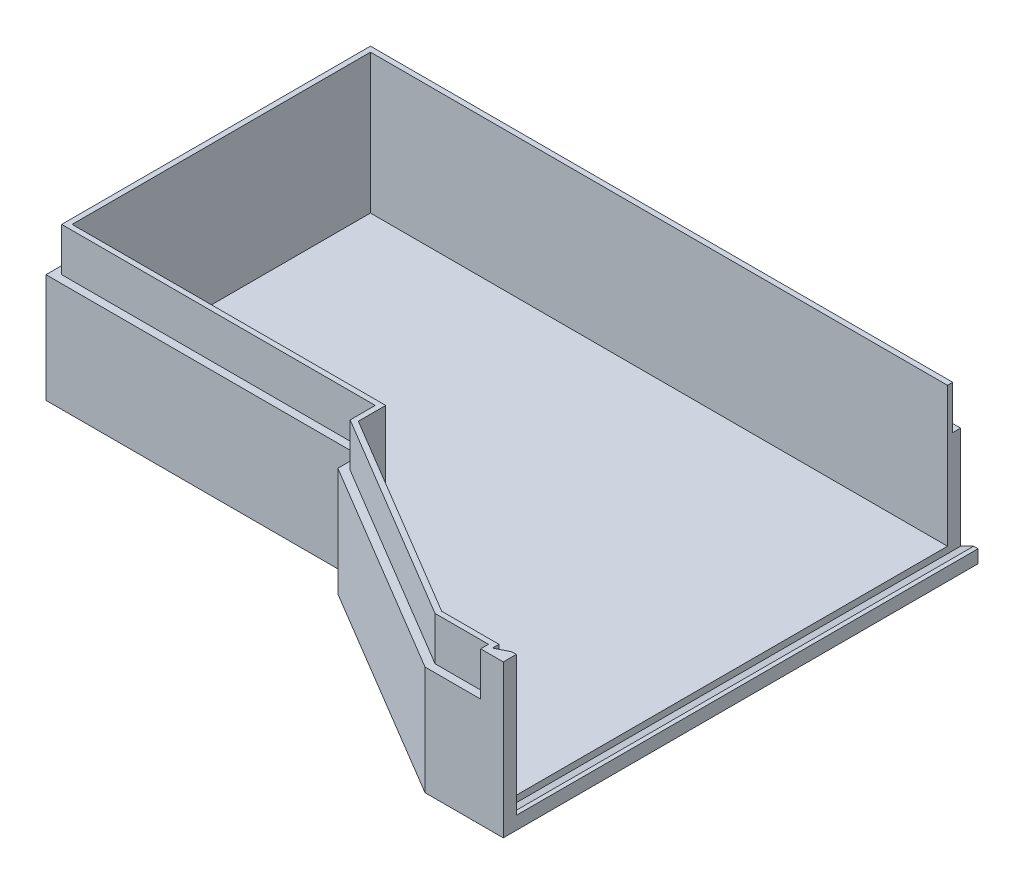
from build123d import *

# Parameters (mm, degrees)
BOSS_EXTRUDE1_DEPTH = 35
CUT_EXTRUDE1_DEPTH  = 32
SKETCH5_W           = 4
SKETCH5_H           = 106
CUT_EXTRUDE2_DEPTH  = 32
SKETCH6_W           = 3
SKETCH6_H           = 106
CUT_EXTRUDE3_DEPTH  = 1.5
SKETCH7_W           = 3
SKETCH7_H           = 33.5
CUT_EXTRUDE4_DEPTH  = 1.5
CUT_EXTRUDE5_DEPTH  = 10
BOSS_EXTRUDE2_DEPTH = 33.5
BOSS_EXTRUDE3_DEPTH = 109


with BuildPart() as part:
    # PCB → Boss-Extrude1 (new body)
    with BuildSketch(Plane(origin=(0, 0, 0), x_dir=(1, 0, 0), z_dir=(0, 1, 0))):
        Polygon((68.5, -75.988917258), (118.036460317, -105.5), (135, -105.5), (136, -105.5), (136, 3.5), (135, 3.5), (-3.5, 3.5), (-3.5, -71), (68.5, -71), align=None)
    extrude(amount=BOSS_EXTRUDE1_DEPTH)

    # Sketch4 → Cut-Extrude1 (cut)
    with BuildSketch(Plane(origin=(0, 35, 0), x_dir=(1, 0, 0), z_dir=(0, 1, 0))):
        Polygon((133, 0.5), (-0.5, 0.5), (-0.5, -68), (71.5, -68), (71.5, -74.284131037), (118.862351474, -102.5), (133, -102.5), align=None)
    extrude(amount=-CUT_EXTRUDE1_DEPTH, mode=Mode.SUBTRACT)

    # Sketch5 → Cut-Extrude2 (cut)
    with BuildSketch(Plane(origin=(0, 35, 0), x_dir=(1, 0, 0), z_dir=(0, 1, 0))):
        with Locations((134, -49.5)):
            Rectangle(SKETCH5_W, SKETCH5_H)
    extrude(amount=-CUT_EXTRUDE2_DEPTH, mode=Mode.SUBTRACT)

    # Sketch6 → Cut-Extrude3 (cut)
    with BuildSketch(Plane(origin=(0, 3, 0), x_dir=(1, 0, 0), z_dir=(0, 1, 0))):
        with Locations((133.5, -49.5)):
            Rectangle(SKETCH6_W, SKETCH6_H)
    extrude(amount=-CUT_EXTRUDE3_DEPTH, mode=Mode.SUBTRACT)

    # Sketch7 → Cut-Extrude4 (cut)
    with BuildSketch(Plane(origin=(0, 0, 102.5), x_dir=(-1, 0, 0), z_dir=(0, 0, -1))):
        with Locations((-133.5, 18.25)):
            Rectangle(SKETCH7_W, SKETCH7_H)
    extrude(amount=-CUT_EXTRUDE4_DEPTH, mode=Mode.SUBTRACT)

    # Sketch10 → Cut-Extrude5 (cut)
    with BuildSketch(Plane(origin=(0, 35, 0), x_dir=(1, 0, 0), z_dir=(0, 1, 0))):
        Polygon((130.8, -105.5), (118.036460317, -105.5), (68.5, -75.988917258), (68.5, -71), (-3.5, -71), (-3.5, 3.5), (132, 3.5), (132, 1.7), (-1.7, 1.7), (-1.7, -69.2), (70.3, -69.2), (70.3, -74.966045525), (118.531995011, -103.7), (130.8, -103.7), align=None)
    extrude(amount=-CUT_EXTRUDE5_DEPTH, mode=Mode.SUBTRACT)

    # Sketch11 → Boss-Extrude2 (add)
    with BuildSketch(Plane(origin=(0, 1.5, 0), x_dir=(1, 0, 0), z_dir=(0, 1, 0))):
        Polygon((132, -104), (135, -102.5), (135, -104), align=None)
    extrude(amount=BOSS_EXTRUDE2_DEPTH)

    # Sketch13 → Boss-Extrude3 (add)
    with BuildSketch(Plane.XY.offset(105.5)):
        Polygon((132, 1.5), (135, 3), (135, 1.5), align=None)
    extrude(amount=-BOSS_EXTRUDE3_DEPTH)


solid = part.part
